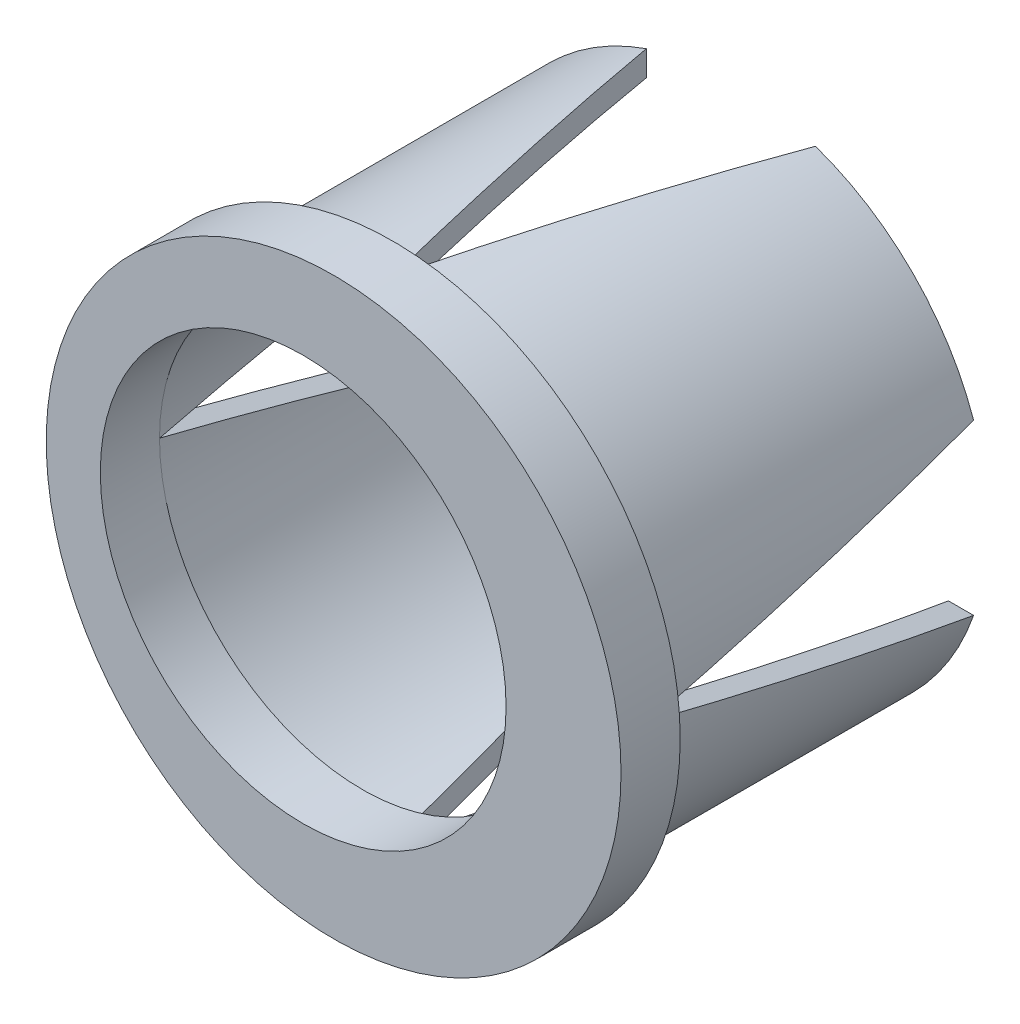
from build123d import *

# Parameters (mm, degrees)
SKETCH2_R               = 10.795
SKETCH2_R_2             = 7.62
BOSS_EXTRUDE1_DEPTH     = 2.2225
SKETCH2_4_R             = 9.652
BOSS_EXTRUDE2_DEPTH     = 12.7
CUT_EXTRUDE1_DEPTH      = 12.7
CUT_EXTRUDE1_DEPTH_BACK = 12.7
CUT_EXTRUDE2_DEPTH      = 12.7
CUT_EXTRUDE2_DEPTH_BACK = 12.7


with BuildPart() as part:
    # Sketch2 → Boss-Extrude1 (new body)
    with BuildSketch(Plane.XY):
        Circle(SKETCH2_R)
        with Locations((-1.143, 0)):
            Circle(SKETCH2_R_2, mode=Mode.SUBTRACT)
    extrude(amount=BOSS_EXTRUDE1_DEPTH)

    # Sketch2<4> → Boss-Extrude2 (add)
    with BuildSketch(Plane.XY):
        Circle(SKETCH2_4_R)
        with BuildLine():
            ThreePointArc((8.763, 0), (7.7e-08, -8.763), (-8.763, -1.54e-07))
            ThreePointArc((-8.763, -1.54e-07), (-7.7e-08, 8.763), (8.763, 0))
        make_face(mode=Mode.SUBTRACT)
    extrude(amount=-BOSS_EXTRUDE2_DEPTH)

    # Sketch3 → Cut-Extrude1 (cut, two sides: drawn at the far end of the back side and taken through both)
    with BuildSketch(Plane(origin=(0, 0, 0), x_dir=(1, 0, 0), z_dir=(0, 1, 0)).offset(-CUT_EXTRUDE1_DEPTH_BACK)):
        Polygon((0, 0), (3.175, 12.7), (-3.175, 12.7), align=None)
    extrude(amount=CUT_EXTRUDE1_DEPTH + CUT_EXTRUDE1_DEPTH_BACK, mode=Mode.SUBTRACT)

    # Sketch5 → Cut-Extrude2 (cut, two sides: drawn at the far end of the back side and taken through both)
    with BuildSketch(Plane(origin=(0, 0, 0), x_dir=(0, 0, -1), z_dir=(1, 0, 0)).offset(-CUT_EXTRUDE2_DEPTH_BACK)):
        Polygon((0, 0), (12.7, 3.175), (12.7, -3.175), align=None)
    extrude(amount=CUT_EXTRUDE2_DEPTH + CUT_EXTRUDE2_DEPTH_BACK, mode=Mode.SUBTRACT)


solid = part.part
